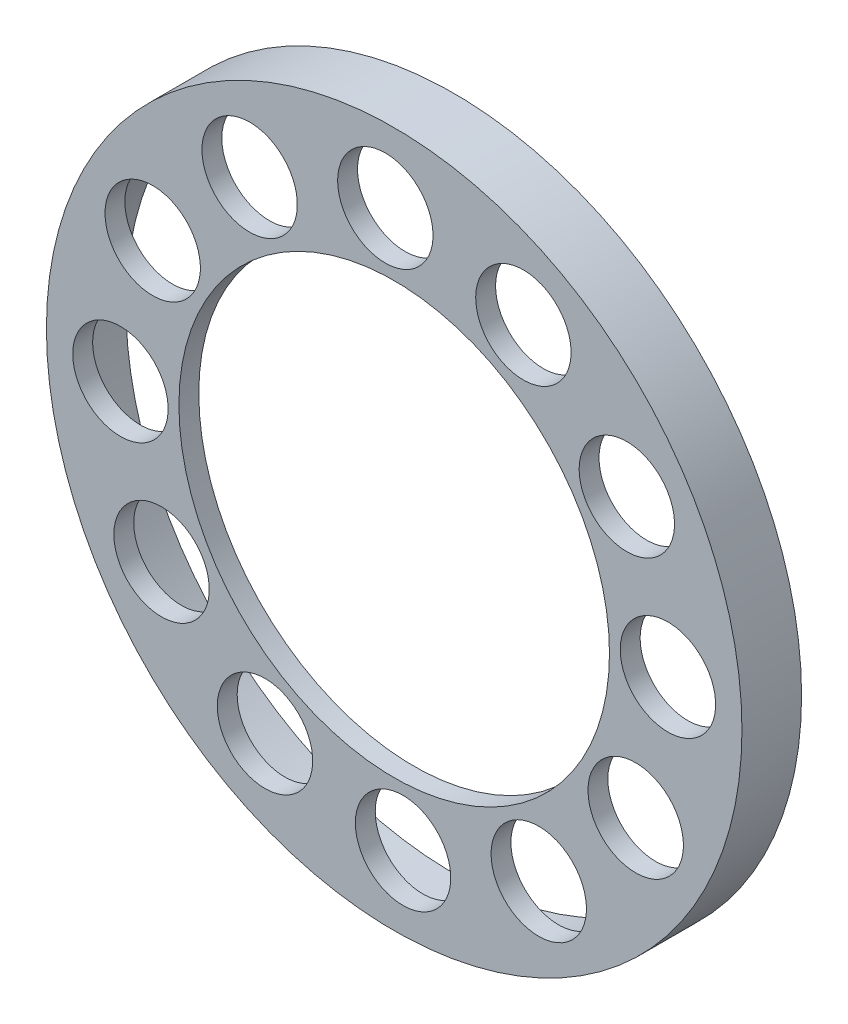
from build123d import *

# Parameters (mm, degrees)
SKETCH1_R           = 13.335
SKETCH1_R_2         = 8.255
SKETCH1_R_3         = 1.8288
BOSS_EXTRUDE1_DEPTH = 0.762
BOSS_EXTRUDE2_START = 1.524
SKETCH2_R           = 13.335
SKETCH2_R_2         = 12.573
BOSS_EXTRUDE2_DEPTH = 1.524


with BuildPart() as part:
    # Sketch1 → Boss-Extrude1 (new body)
    with BuildSketch(Plane.XY):
        with Locations(Location((0, 0, 0), (0, 0, 180))):
            Circle(SKETCH1_R)
        with Locations(Location((0, 0, 0), (0, 0, 180))):
            Circle(SKETCH1_R_2, mode=Mode.SUBTRACT)
        with Locations(Location((8.919971224, 5.542595082, 0), (0, 0, 180))):
            Circle(SKETCH1_R_3, mode=Mode.SUBTRACT)
        with Locations(Location((10.496219222, 0.340042532, 0), (0, 0, 180))):
            Circle(SKETCH1_R_3, mode=Mode.SUBTRACT)
        with Locations(Location((9.260013756, -4.95362414, 0), (0, 0, 180))):
            Circle(SKETCH1_R_3, mode=Mode.SUBTRACT)
        with Locations(Location((5.542595082, -8.919971224, 0), (0, 0, 180))):
            Circle(SKETCH1_R_3, mode=Mode.SUBTRACT)
        with Locations(Location((0.340042532, -10.496219222, 0), (0, 0, 180))):
            Circle(SKETCH1_R_3, mode=Mode.SUBTRACT)
        with Locations(Location((-4.95362414, -9.260013756, 0), (0, 0, 180))):
            Circle(SKETCH1_R_3, mode=Mode.SUBTRACT)
        with Locations(Location((-8.919971224, -5.542595082, 0), (0, 0, 180))):
            Circle(SKETCH1_R_3, mode=Mode.SUBTRACT)
        with Locations(Location((-10.496219222, -0.340042532, 0), (0, 0, 180))):
            Circle(SKETCH1_R_3, mode=Mode.SUBTRACT)
        with Locations(Location((-9.260013756, 4.95362414, 0), (0, 0, 180))):
            Circle(SKETCH1_R_3, mode=Mode.SUBTRACT)
        with Locations(Location((-5.542595082, 8.919971224, 0), (0, 0, 180))):
            Circle(SKETCH1_R_3, mode=Mode.SUBTRACT)
        with Locations(Location((-0.340042532, 10.496219222, 0), (0, 0, 180))):
            Circle(SKETCH1_R_3, mode=Mode.SUBTRACT)
        with Locations(Location((4.95362414, 9.260013756, 0), (0, 0, 180))):
            Circle(SKETCH1_R_3, mode=Mode.SUBTRACT)
    extrude(amount=BOSS_EXTRUDE1_DEPTH)

    # Sketch2 → Boss-Extrude2 (add)
    with BuildSketch(Plane(origin=(0, 0, 0), x_dir=(-1, 0, 0), z_dir=(0, 0, -1)).offset(BOSS_EXTRUDE2_START)):
        Circle(SKETCH2_R)
        with Locations(Location((0, 0, 0), (0, 0, 180))):
            Circle(SKETCH2_R_2, mode=Mode.SUBTRACT)
    extrude(amount=-BOSS_EXTRUDE2_DEPTH)


solid = part.part
